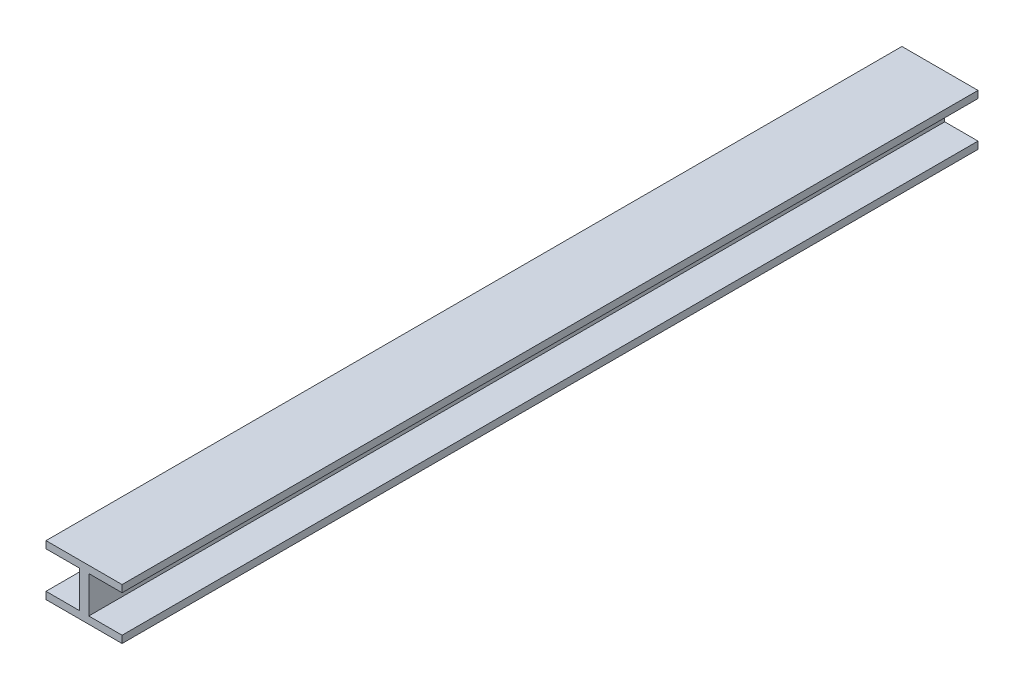
from build123d import *

# Parameters (mm, degrees)
BOSS_EXTRUDE1_DEPTH = 450


with BuildPart() as part:
    # Sketch1 → Boss-Extrude1 (new body)
    with BuildSketch(Plane.XY):
        Polygon((0, 0), (-17.5, 0), (-17.5, -3.795180723), (22.5, -3.795180723), (22.5, 0), (5, 0), (5, 19.337349398), (22.5, 19.337349398), (22.5, 23.072289157), (-17.5, 23.072289157), (-17.5, 19.337349398), (0, 19.337349398), align=None)
    extrude(amount=BOSS_EXTRUDE1_DEPTH)


solid = part.part
